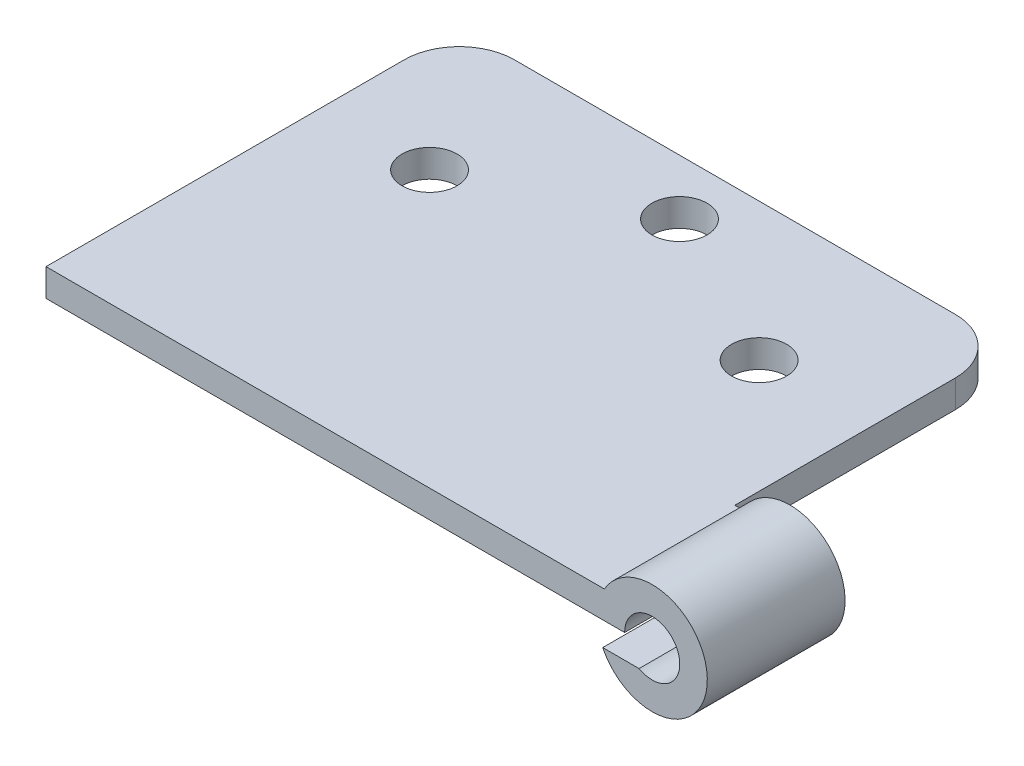
from build123d import *

# Parameters (mm, degrees)
SKETCH2_R           = 10
BOSS_EXTRUDE2_DEPTH = 10
BOSS_EXTRUDE4_DEPTH = 50


with BuildPart() as part:
    # Sketch2 → Boss-Extrude2 (new body)
    with BuildSketch(Plane(origin=(0, 0, 0), x_dir=(1, 0, 0), z_dir=(0, 1, 0))):
        with BuildLine():
            Line((-100, -50), (100, -50))
            Line((100, -50), (100, 30))
            ThreePointArc((100, 30), (94.142135624, 44.142135624), (80, 50))
            Line((80, 50), (-80, 50))
            ThreePointArc((-80, 50), (-94.142135624, 44.142135624), (-100, 30))
            Line((-100, 30), (-100, -50))
        make_face()
        with Locations(Location((58.793969849, 0, 0), (0, 0, 270))):
            Circle(SKETCH2_R, mode=Mode.SUBTRACT)
        with Locations(Location((-60.804020101, 0, 0), (0, 0, 270))):
            Circle(SKETCH2_R, mode=Mode.SUBTRACT)
        with Locations(Location((0, 29.899497487, 0), (0, 0, 270))):
            Circle(SKETCH2_R, mode=Mode.SUBTRACT)
    extrude(amount=BOSS_EXTRUDE2_DEPTH)

    # Sketch3 → Boss-Extrude4 (add)
    with BuildSketch(Plane.XY.offset(50)):
        with BuildLine():
            Line((100, 10), (102.633258285, 10))
            ThreePointArc((102.633258285, 10), (139.989628378, -0.558774103), (102.0351621, -8.710129001))
            Line((102.0351621, -8.710129001), (115.232280048, -8.710129001))
            ThreePointArc((115.232280048, -8.710129001), (128.572143936, 5.229557302), (110.000160919, 0))
            Line((110.000160919, 0), (100, 0))
            Line((100, 0), (-100, 0))
            Line((-100, 0), (-100, 10))
            Line((-100, 10), (100, 10))
        make_face()
    extrude(amount=BOSS_EXTRUDE4_DEPTH)


solid = part.part
